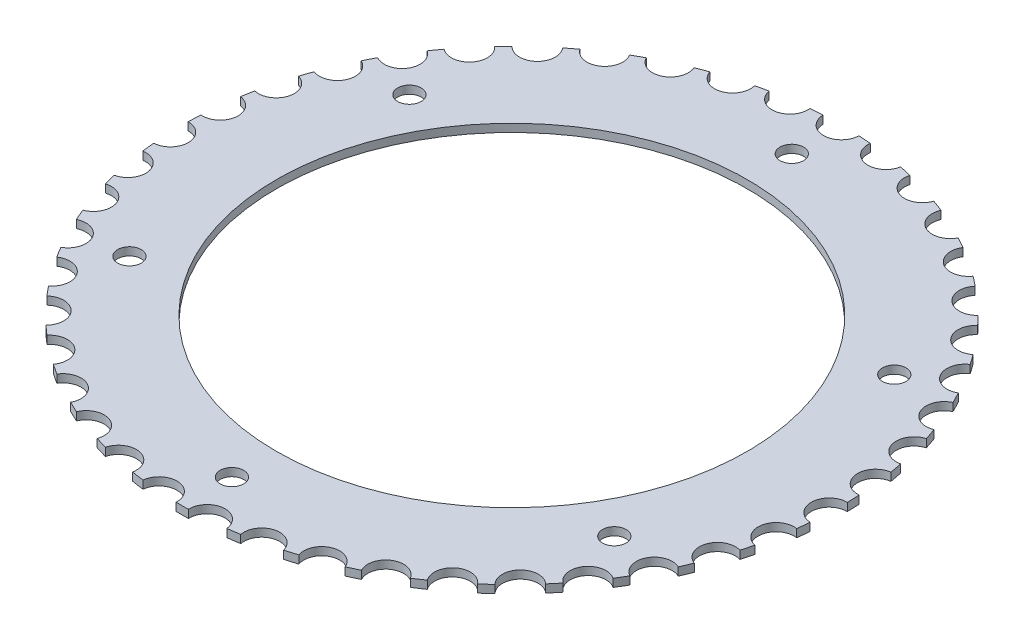
from build123d import *

# Parameters (mm, degrees)
SKETCH1_R           = 70
SKETCH1_R_2         = 50
BOSS_EXTRUDE1_DEPTH = 1.7
SKETCH3_R           = 3.81
CUT_EXTRUDE1_DEPTH  = 2.54
CIRPATTERN1_COUNT   = 43
SKETCH5_R           = 2.5
CUT_EXTRUDE2_DEPTH  = 10


with BuildPart() as part:
    # Sketch1 → Boss-Extrude1 (new body)
    with BuildSketch(Plane(origin=(0, 0, 0), x_dir=(1, 0, 0), z_dir=(0, 1, 0))):
        with Locations(Location((0, 0, 0), (0, 0, 270))):
            Circle(SKETCH1_R)
        with Locations(Location((0, 0, 0), (0, 0, 270))):
            Circle(SKETCH1_R_2, mode=Mode.SUBTRACT)
    extrude(amount=BOSS_EXTRUDE1_DEPTH)

    # Sketch3 → Cut-Extrude1 (cut)
    with BuildSketch(Plane(origin=(0, 1.7, 0), x_dir=(1, 0, 0), z_dir=(0, 1, 0))):
        with Locations((0, 70)):
            Circle(SKETCH3_R)
    cut_extrude1 = extrude(amount=-CUT_EXTRUDE1_DEPTH, mode=Mode.SUBTRACT)

    # CirPattern1: Cut-Extrude1 ×43 about axis
    cirpattern1_axis = Axis((0, 0, 0), (0, 1, 0))
    for i in range(1, CIRPATTERN1_COUNT):
        add(cut_extrude1.rotate(cirpattern1_axis, i * 360 / CIRPATTERN1_COUNT), mode=Mode.SUBTRACT)

    # Sketch5 → Cut-Extrude2 (cut)
    with BuildSketch(Plane(origin=(0, 0, 0), x_dir=(-1, 0, 0), z_dir=(0, -1, 0))):
        with Locations(Location((0, 59.449975509, 0), (0, 0, 90))):
            Circle(SKETCH5_R)
        with Locations(Location((51.485189045, 29.724987755, 0), (0, 0, 90))):
            Circle(SKETCH5_R)
        with Locations(Location((51.485189045, -29.724987755, 0), (0, 0, 90))):
            Circle(SKETCH5_R)
        with Locations(Location((0, -59.449975509, 0), (0, 0, 90))):
            Circle(SKETCH5_R)
        with Locations(Location((-51.485189045, -29.724987755, 0), (0, 0, 90))):
            Circle(SKETCH5_R)
        with Locations(Location((-51.485189045, 29.724987755, 0), (0, 0, 90))):
            Circle(SKETCH5_R)
    extrude(amount=-CUT_EXTRUDE2_DEPTH, mode=Mode.SUBTRACT)


solid = part.part
